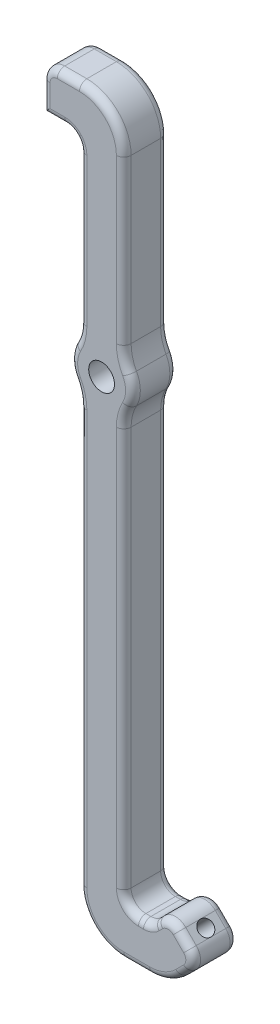
from build123d import *

# Parameters (mm, degrees)
ESQUISSE1_W                  = 6
ESQUISSE1_H                  = 100
BOSS_EXTRU_1_DEPTH           = 6
ESQUISSE2_W                  = 5
ESQUISSE2_H                  = 6
BOSS_EXTRU_2_DEPTH           = 6
ESQUISSE3_R                  = 4.25
ESQUISSE3_R_2                = 1.75
BOSS_EXTRU_3_DEPTH           = 6
ENL_V_MAT_EXTRU_1_DEPTH      = 101.441836403
ENL_V_MAT_EXTRU_1_DEPTH_BACK = 101.441836403
ESQUISSE4_R                  = 1.75
BOSS_EXTRU_4_DEPTH           = 6
CONG_1_R                     = 6
CONG_2_R                     = 2
ESQUISSE6_R                  = 1
ENL_V_MAT_EXTRU_3_DEPTH      = 6
CONG_3_R                     = 1


with BuildPart() as part:
    # Esquisse1 → Boss.-Extru.1 (new body)
    with BuildSketch(Plane.XY):
        with Locations((3, 50)):
            Rectangle(ESQUISSE1_W, ESQUISSE1_H)
    extrude(amount=BOSS_EXTRU_1_DEPTH)

    # Esquisse2 → Boss.-Extru.2 (add)
    with BuildSketch(Plane.XY.offset(6)):
        with Locations((-2.5, 97)):
            Rectangle(ESQUISSE2_W, ESQUISSE2_H)
    extrude(amount=-BOSS_EXTRU_2_DEPTH)

    # Esquisse3 → Boss.-Extru.3 (add)
    with BuildSketch(Plane.XY.offset(6)):
        with Locations((3, 67)):
            Circle(ESQUISSE3_R)
        with Locations((3, 67)):
            Circle(ESQUISSE3_R_2, mode=Mode.SUBTRACT)
    extrude(amount=-BOSS_EXTRU_3_DEPTH)

    # Esquisse4 → Enlèv. mat.-Extru.1 (cut, two sides: drawn at the far end of the back side and taken through both)
    with BuildSketch(Plane.XY.offset(6).offset(-ENL_V_MAT_EXTRU_1_DEPTH_BACK)):
        with Locations((3, 67)):
            Circle(ESQUISSE4_R)
    extrude(amount=ENL_V_MAT_EXTRU_1_DEPTH + ENL_V_MAT_EXTRU_1_DEPTH_BACK, mode=Mode.SUBTRACT)

    # Esquisse5 → Boss.-Extru.4 (add)
    with BuildSketch(Plane.XY.offset(6)):
        Polygon((6, 0), (12, 0), (16.242640687, 4.242640687), (12, 8.485281374), (9.514718626, 6), (6, 6), align=None)
    extrude(amount=-BOSS_EXTRU_4_DEPTH)

    # Congé1
    cong_1_edges = [part.edges().sort_by_distance(p)[0] for p in [
        (0, 70.010398645, 3),
        (6, 70.010398645, 3),
        (0, 63.989601355, 3),
        (6, 63.989601355, 3),
        (12, 0, 3),
        (6, 100, 3),
        (0, 0, 3),
    ]]
    fillet(cong_1_edges, radius=CONG_1_R)

    # Congé2
    cong_2_edges = [part.edges().sort_by_distance(p)[0] for p in [
        (0, 94, 3),
        (-5, 100, 3),
        (6, 6, 3),
        (9.514718626, 6, 3),
        (12, 8.485281374, 3),
        (16.242640687, 4.242640687, 3),
    ]]
    fillet(cong_2_edges, radius=CONG_2_R)

    # Esquisse6 → Enlèv. mat.-Extru.3 (cut)
    with BuildSketch(Plane(origin=(10.242640687, 10.242640687, 0), x_dir=(0, 0, -1), z_dir=(0.7071067811865458, 0.7071067811865492, 0))):
        with Locations(Location((-3, -5.485281374, 0), (0, 0, 90))):
            Circle(ESQUISSE6_R)
    extrude(amount=-ENL_V_MAT_EXTRU_3_DEPTH, mode=Mode.SUBTRACT)

    # Congé3
    cong_3_edges = [part.edges().sort_by_distance(p)[0] for p in [
        (0, 81.952677109, 0),
        (0, 81.952677109, 6),
        (-5, 96, 6),
        (14.121320344, 6.363961031, 6),
        (10.343145751, 6.828427125, 6),
        (8.343145751, 6, 6),
        (6, 35.047322891, 6),
        (12, 7.656854249, 6),
        (15.414213562, 4.242640687, 6),
        (-4.414213562, 99.414213562, 6),
        (-5, 96, 0),
        (6, 35.047322891, 0),
        (8.343145751, 6, 0),
        (10.343145751, 6.828427125, 0),
        (14.121320344, 6.363961031, 0),
        (12, 7.656854249, 0),
        (15.414213562, 4.242640687, 0),
        (-4.414213562, 99.414213562, 0),
        (-0.585786438, 93.414213562, 6),
        (-0.585786438, 93.414213562, 0),
        (9.451658366, 6.152240935, 6),
        (9.451658366, 6.152240935, 0),
        (6.585786438, 6.585786438, 6),
        (6.585786438, 6.585786438, 0),
        (-3.5, 94, 0),
        (-3.5, 94, 6),
        (0, 34.047322891, 6),
        (0, 34.047322891, 0),
        (-1.25, 67, 0),
        (-1.25, 67, 6),
        (7.25, 67, 0),
        (7.25, 67, 6),
        (6, 82.952677109, 6),
        (6, 82.952677109, 0),
        (-1.5, 100, 0),
        (-1.5, 100, 6),
        (14.292893219, 2.292893219, 0),
        (7.757359313, 0, 0),
        (1.757359313, 1.757359313, 0),
        (11.81081922, 0.456722805, 0),
        (4.242640687, 98.242640687, 0),
        (7.757359313, 0, 6),
        (14.292893219, 2.292893219, 6),
        (1.757359313, 1.757359313, 6),
        (11.81081922, 0.456722805, 6),
        (4.242640687, 98.242640687, 6),
        (-0.185803749, 63.576240177, 0),
        (-0.185803749, 63.576240177, 6),
        (-0.185803749, 70.423759823, 6),
        (-0.185803749, 70.423759823, 0),
        (6.185803749, 63.576240177, 6),
        (6.185803749, 63.576240177, 0),
        (6.185803749, 70.423759823, 0),
        (6.185803749, 70.423759823, 6),
    ]]
    fillet(cong_3_edges, radius=CONG_3_R)


solid = part.part
